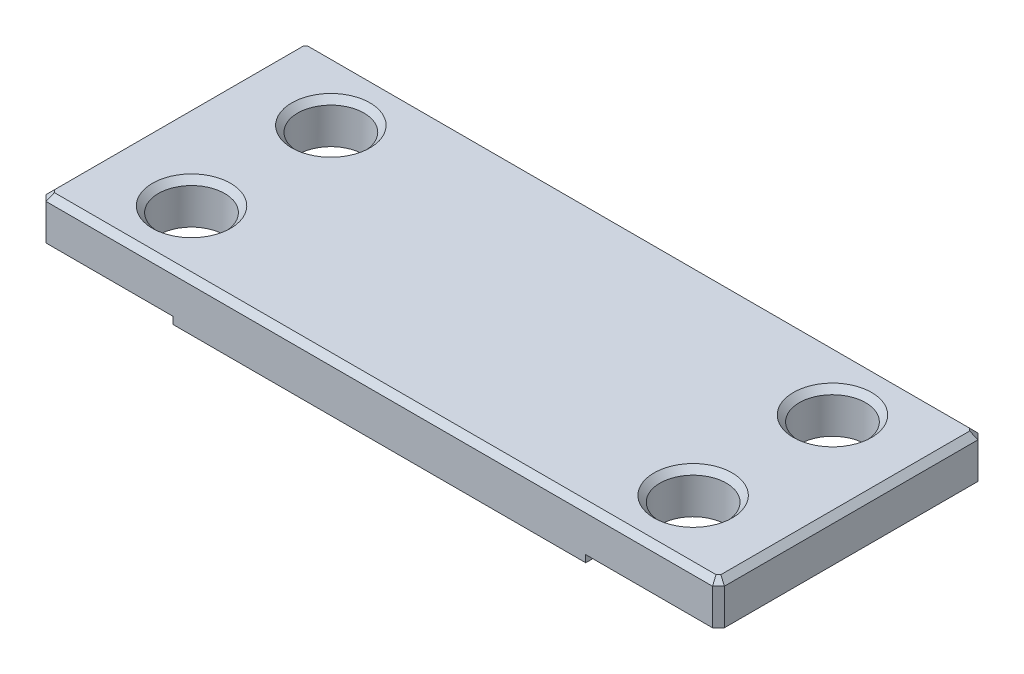
from build123d import *

# Parameters (mm, degrees)
SKETCH1_W                       = 73.025
SKETCH1_H                       = 28.575
BOSS_EXTRUDE1_DEPTH             = 5.2740052
SKETCH2_W                       = 14.2875
SKETCH2_H                       = 0.762
CUT_EXTRUDE1_DEPTH              = 47.663780517
F_9_32_0_28125_DIAMETER_HOLE1_D = 7.14375
CHAMFER1_SIZE                   = 0.635
CHAMFER2_SIZE                   = 0.635


with BuildPart() as part:
    # Sketch1 → Boss-Extrude1 (new body)
    with BuildSketch(Plane(origin=(0, 0, 0), x_dir=(1, 0, 0), z_dir=(0, 1, 0))):
        Rectangle(SKETCH1_W, SKETCH1_H)
    extrude(amount=BOSS_EXTRUDE1_DEPTH)

    # Sketch2 → Cut-Extrude1 (cut, through all)
    with BuildSketch(Plane.XY.offset(14.2875)):
        with Locations((-29.36875, 0.381)):
            Rectangle(SKETCH2_W, SKETCH2_H)
        with Locations((29.36875, 0.381)):
            Rectangle(SKETCH2_W, SKETCH2_H)
    extrude(amount=-CUT_EXTRUDE1_DEPTH, mode=Mode.SUBTRACT)

    # 9/32 (0.28125) Diameter Hole1 (through all)
    with Locations(Plane(origin=(0, 5.2740052, 0), x_dir=(-1, 0, 0), z_dir=(0, 1, 0))):
        with Locations((27, -7.5), (-27, 7.5), (-27, -7.5), (27, 7.5)):
            Hole(F_9_32_0_28125_DIAMETER_HOLE1_D / 2)

    # Chamfer1
    chamfer1_edges = [part.edges().sort_by_distance(p)[0] for p in [
        (36.5125, 3.0180026, 14.2875),
        (-36.5125, 3.0180026, 14.2875),
        (-36.5125, 3.0180026, -14.2875),
        (36.5125, 3.0180026, -14.2875),
    ]]
    chamfer(chamfer1_edges, length=CHAMFER1_SIZE)

    # Chamfer2
    chamfer2_edges = [part.edges().sort_by_distance(p)[0] for p in [
        (-30.571875, 5.2740052, 7.5),
        (23.428125, 5.2740052, -7.5),
        (23.428125, 5.2740052, 7.5),
        (-30.571875, 5.2740052, -7.5),
        (36.5125, 5.2740052, 0),
        (0, 5.2740052, 14.2875),
        (0, 5.2740052, -14.2875),
        (-36.5125, 5.2740052, 0),
        (-36.195, 5.2740052, 13.97),
        (-36.195, 5.2740052, -13.97),
        (36.195, 5.2740052, -13.97),
        (36.195, 5.2740052, 13.97),
    ]]
    chamfer(chamfer2_edges, length=CHAMFER2_SIZE)


solid = part.part
